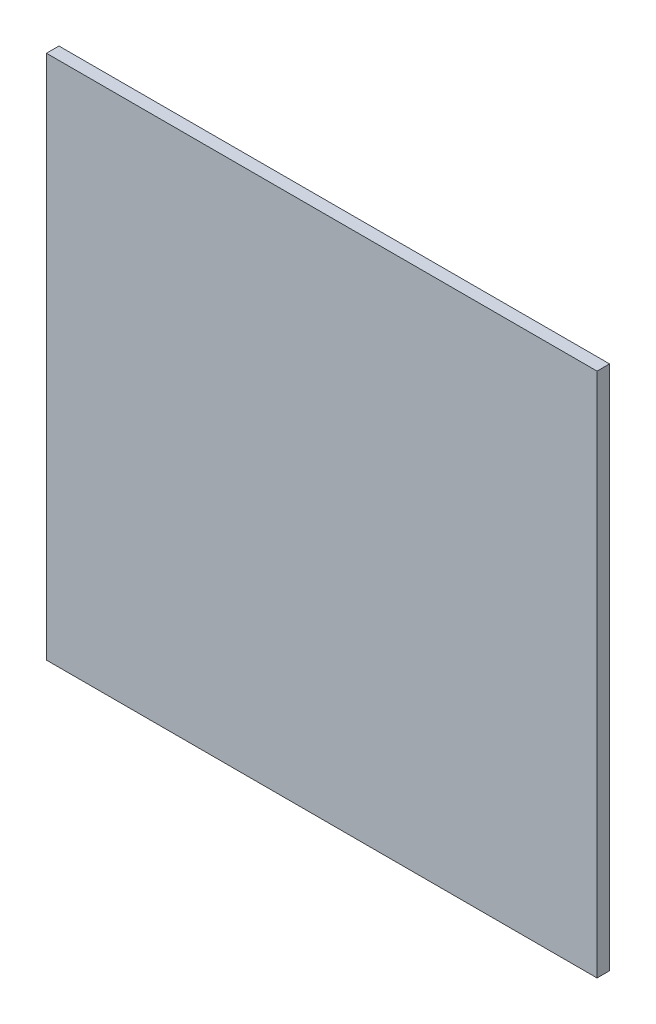
from build123d import *

# Parameters (mm, degrees)
ESQUISSE1_W        = 44
ESQUISSE1_H        = 42
BOSS_EXTRU_1_DEPTH = 1


with BuildPart() as part:
    # Esquisse1 → Boss.-Extru.1 (new body)
    with BuildSketch(Plane.XY):
        Rectangle(ESQUISSE1_W, ESQUISSE1_H)
    extrude(amount=BOSS_EXTRU_1_DEPTH)


solid = part.part
